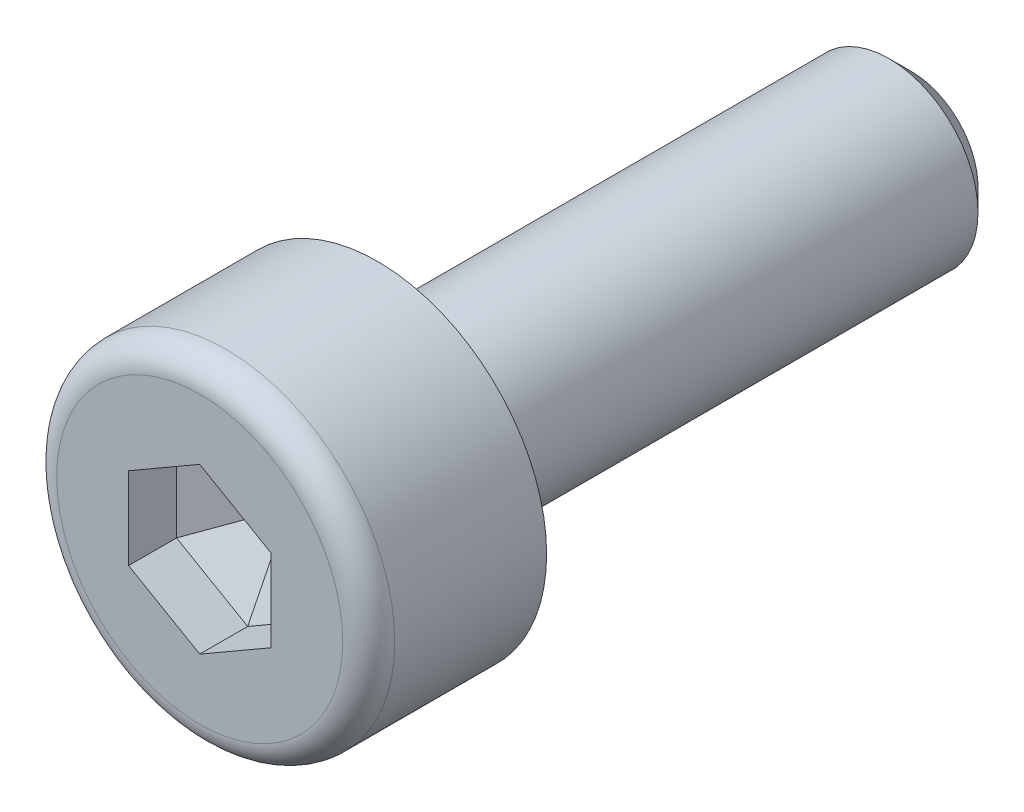
from build123d import *
from OCP.BRepFilletAPI import BRepFilletAPI_MakeChamfer

# Parameters (mm, degrees)
SKETCH_1_R          = 1.9
EXTRUDE_1_DEPTH     = 2
CUT_EXTRUDE_1_DEPTH = 1
SKETCH_3_R          = 1
EXTRUDE_2_DEPTH     = 6
CHAMFER_1_SIZE      = 0.25
FILLET_1_R          = 0.292307692
CHAMFER_2_SIZE      = 0.461095101
CHAMFER_2_SIZE2     = 0.798640142
FILLET_2_R          = 0.1


with BuildPart() as part:
    # 草图1 → 凸台-拉伸1 (new body)
    with BuildSketch(Plane.XY):
        Circle(SKETCH_1_R)
    extrude(amount=EXTRUDE_1_DEPTH)

    # 草图2 → 切除-拉伸1 (cut)
    with BuildSketch(Plane.XY.offset(2)):
        Polygon((0.8, 0.461880215), (0, 0.923760431), (-0.8, 0.461880215), (-0.8, -0.461880215), (0, -0.923760431), (0.8, -0.461880215), align=None)
    extrude(amount=-CUT_EXTRUDE_1_DEPTH, mode=Mode.SUBTRACT)

    # 草图3 → 凸台-拉伸2 (add)
    with BuildSketch(Plane(origin=(0, 0, 0), x_dir=(-1, 0, 0), z_dir=(0, 0, -1))):
        Circle(SKETCH_3_R)
    extrude(amount=EXTRUDE_2_DEPTH)

    # 倒角1
    chamfer_1_edges = [part.edges().sort_by_distance(p)[0] for p in [
        (1, 0, -6),
    ]]
    chamfer(chamfer_1_edges, length=CHAMFER_1_SIZE)

    # 圆角1
    fillet_1_edges = [part.edges().sort_by_distance(p)[0] for p in [
        (-1.9, 0, 2),
    ]]
    fillet(fillet_1_edges, radius=FILLET_1_R)

    # 倒角2: one chamfer whose edges measure the first distance from different faces: ONE call of the kernel's chamfer builder (chamfer() names one face for all edges)
    chamfer_2_edges_1 = [part.edges().sort_by_distance(p)[0] for p in [
        (-0.8, 0, 1),
    ]]
    chamfer_2_side_1 = [part.faces().sort_by_distance(p)[0] for p in [
        (-0.8, 0, 1.5),
    ]]
    chamfer_2_edges_2 = [part.edges().sort_by_distance(p)[0] for p in [
        (-0.4, 0.692820323, 1),
    ]]
    chamfer_2_side_2 = [part.faces().sort_by_distance(p)[0] for p in [
        (-0.4, 0.692820323, 1.5),
    ]]
    chamfer_2_edges_3 = [part.edges().sort_by_distance(p)[0] for p in [
        (0.4, 0.692820323, 1),
    ]]
    chamfer_2_side_3 = [part.faces().sort_by_distance(p)[0] for p in [
        (0.4, 0.692820323, 1.5),
    ]]
    chamfer_2_edges_4 = [part.edges().sort_by_distance(p)[0] for p in [
        (0.8, 0, 1),
    ]]
    chamfer_2_side_4 = [part.faces().sort_by_distance(p)[0] for p in [
        (0.8, 0, 1.5),
    ]]
    chamfer_2_edges_5 = [part.edges().sort_by_distance(p)[0] for p in [
        (-0.4, -0.692820323, 1),
    ]]
    chamfer_2_side_5 = [part.faces().sort_by_distance(p)[0] for p in [
        (-0.4, -0.692820323, 1.5),
    ]]
    chamfer_2_edges_6 = [part.edges().sort_by_distance(p)[0] for p in [
        (0.4, -0.692820323, 1),
    ]]
    chamfer_2_side_6 = [part.faces().sort_by_distance(p)[0] for p in [
        (0.4, -0.692820323, 1.5),
    ]]
    chamfer_2 = BRepFilletAPI_MakeChamfer(part.part.solid().wrapped)
    for e in chamfer_2_edges_1:
        chamfer_2.Add(CHAMFER_2_SIZE, CHAMFER_2_SIZE2, e.wrapped, chamfer_2_side_1[0].wrapped)  # the first distance lies on this face
    for e in chamfer_2_edges_2:
        chamfer_2.Add(CHAMFER_2_SIZE, CHAMFER_2_SIZE2, e.wrapped, chamfer_2_side_2[0].wrapped)  # the first distance lies on this face
    for e in chamfer_2_edges_3:
        chamfer_2.Add(CHAMFER_2_SIZE, CHAMFER_2_SIZE2, e.wrapped, chamfer_2_side_3[0].wrapped)  # the first distance lies on this face
    for e in chamfer_2_edges_4:
        chamfer_2.Add(CHAMFER_2_SIZE, CHAMFER_2_SIZE2, e.wrapped, chamfer_2_side_4[0].wrapped)  # the first distance lies on this face
    for e in chamfer_2_edges_5:
        chamfer_2.Add(CHAMFER_2_SIZE, CHAMFER_2_SIZE2, e.wrapped, chamfer_2_side_5[0].wrapped)  # the first distance lies on this face
    for e in chamfer_2_edges_6:
        chamfer_2.Add(CHAMFER_2_SIZE, CHAMFER_2_SIZE2, e.wrapped, chamfer_2_side_6[0].wrapped)  # the first distance lies on this face
    add(Compound.cast(chamfer_2.Shape()), mode=Mode.REPLACE)

    # 圆角2
    fillet_2_edges = [part.edges().sort_by_distance(p)[0] for p in [
        (1, 0, 0),
    ]]
    fillet(fillet_2_edges, radius=FILLET_2_R)


solid = part.part
